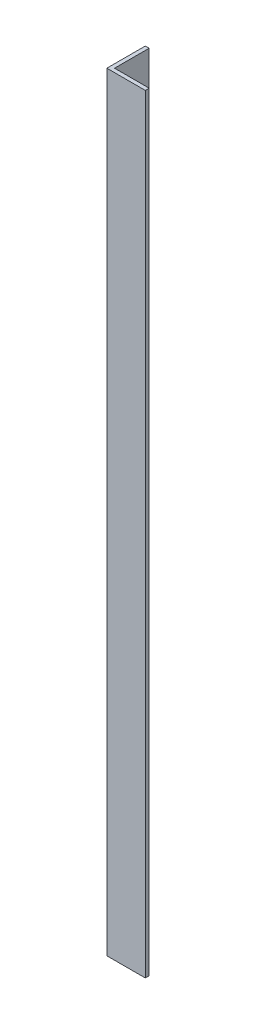
from build123d import *

# Parameters (mm, degrees)
BOSS_EXTRUDE1_DEPTH = 400


with BuildPart() as part:
    # Sketch1 → Boss-Extrude1 (new body)
    with BuildSketch(Plane(origin=(0, 0, 0), x_dir=(1, 0, 0), z_dir=(0, 1, 0))):
        Polygon((0, 0), (0, -20), (20, -20), (20, -18), (2, -18), (2, 0), align=None)
    extrude(amount=BOSS_EXTRUDE1_DEPTH)


solid = part.part
